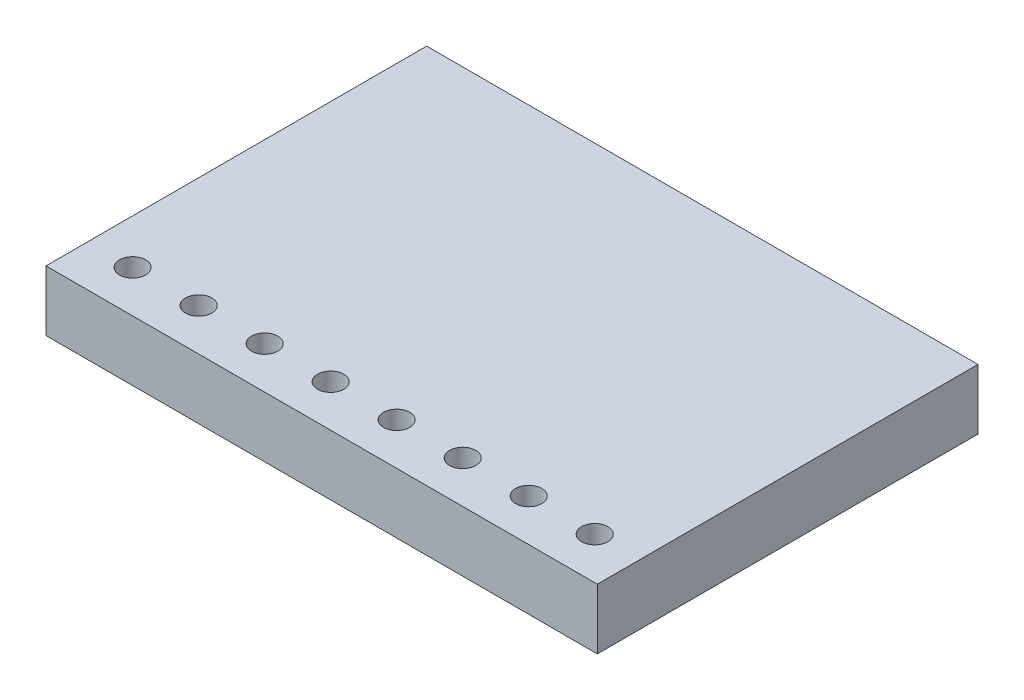
from build123d import *

# Parameters (mm, degrees)
SKETCH_1_W          = 21
SKETCH_1_H          = 14.5
EXTRUDE_1_DEPTH     = 2.3
SKETCH_2_R          = 0.5
CUT_EXTRUDE_1_DEPTH = 13.965434817


with BuildPart() as part:
    # Эскиз1 → Бобышка-Вытянуть1 (new body)
    with BuildSketch(Plane(origin=(0, 0, 0), x_dir=(1, 0, 0), z_dir=(0, 1, 0))):
        Rectangle(SKETCH_1_W, SKETCH_1_H)
    extrude(amount=EXTRUDE_1_DEPTH)

    # Эскиз2 → Вырез-Вытянуть1 (cut, through all)
    with BuildSketch(Plane(origin=(0, 2.3, 0), x_dir=(1, 0, 0), z_dir=(0, 1, 0))):
        with Locations(Location((-8.8, -5.65, 0), (0, 0, 270))):
            Circle(SKETCH_2_R)
        with Locations(Location((-6.285714286, -5.65, 0), (0, 0, 270))):
            Circle(SKETCH_2_R)
        with Locations(Location((-3.771428571, -5.65, 0), (0, 0, 270))):
            Circle(SKETCH_2_R)
        with Locations(Location((-1.257142857, -5.65, 0), (0, 0, 270))):
            Circle(SKETCH_2_R)
        with Locations(Location((1.257142857, -5.65, 0), (0, 0, 270))):
            Circle(SKETCH_2_R)
        with Locations(Location((3.771428571, -5.65, 0), (0, 0, 270))):
            Circle(SKETCH_2_R)
        with Locations(Location((6.285714286, -5.65, 0), (0, 0, 270))):
            Circle(SKETCH_2_R)
        with Locations(Location((8.8, -5.65, 0), (0, 0, 270))):
            Circle(SKETCH_2_R)
    extrude(amount=-CUT_EXTRUDE_1_DEPTH, mode=Mode.SUBTRACT)


solid = part.part
